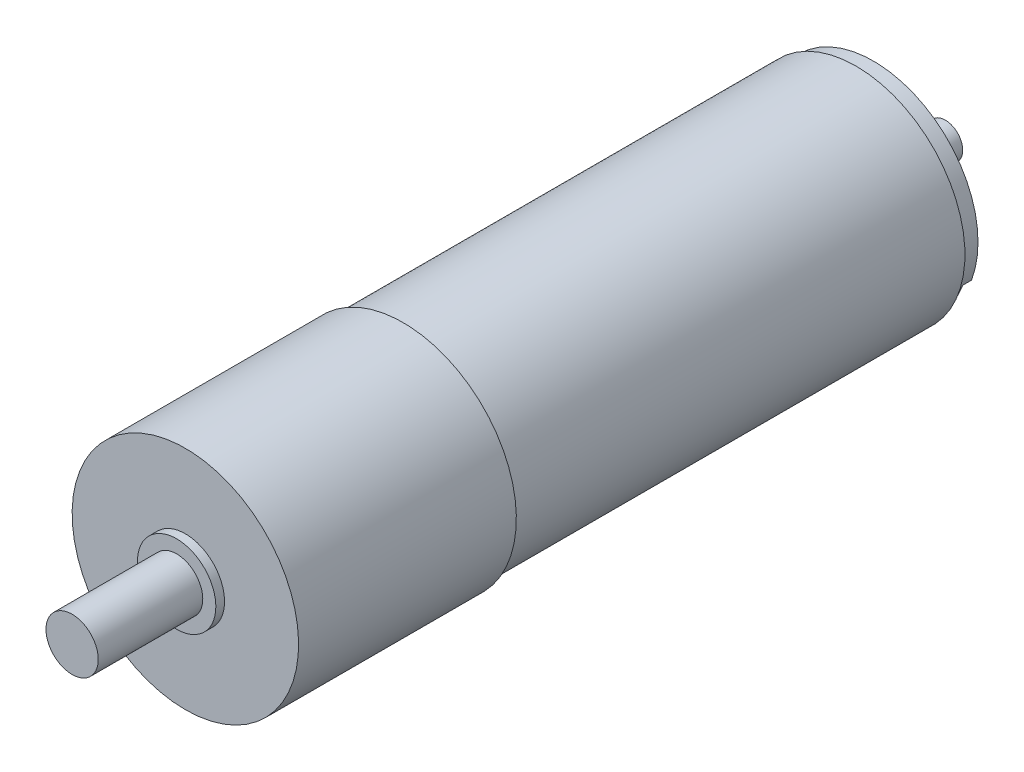
from build123d import *

# Parameters (mm, degrees)
SKETCH3_R          = 2.8
CUT_EXTRUDE2_DEPTH = 3.25
CUT_EXTRUDE3_DEPTH = 2


with BuildPart() as part:
    # Sketch1 → Revolve1 (revolve)
    with BuildSketch(Plane(origin=(0, 0, 0), x_dir=(0, 0, -1), z_dir=(1, 0, 0)), mode=Mode.PRIVATE) as revolve1_sk:
        Polygon((-76, 0), (124.5, 0), (124.5, 4), (109, 4), (109, 8), (108, 8), (108, 24), (104, 24), (104, 25), (0, 25), (0, 26), (-50, 26), (-50, 9), (-52, 9), (-52, 6), (-76, 6), align=None)
    revolve(revolve1_sk.sketch.rotate(Axis((0, 0, 76), (0, 0, -1)), 180), axis=Axis((0, 0, 76), (0, 0, -1)))

    # Sketch3 → Cut-Extrude2 (cut)
    with BuildSketch(Plane.XY.offset(-108)):
        with Locations(Location((6.767859423, 19.032500593, 0), (0, 0, 180))):
            Circle(SKETCH3_R)
        with Locations(Location((-19.905985431, 3.433910891, 0), (0, 0, 180))):
            Circle(SKETCH3_R)
        with Locations(Location((0, -20.2, 0), (0, 0, 180))):
            Circle(SKETCH3_R)
    extrude(amount=CUT_EXTRUDE2_DEPTH, mode=Mode.SUBTRACT)

    # Sketch4 → Cut-Extrude3 (cut)
    with BuildSketch(Plane(origin=(0, 0, -108), x_dir=(-1, 0, 0), z_dir=(0, 0, -1))):
        Polygon((-22.506441861, -8.334271099), (-16.973308635, -2.811902197), (-2.844949371, -16.967800773), (-8.378082597, -22.490169675), (-11.338488517, -25.444816332), (-25.466847781, -11.288917756), align=None)
    extrude(amount=-CUT_EXTRUDE3_DEPTH, mode=Mode.SUBTRACT)


solid = part.part
